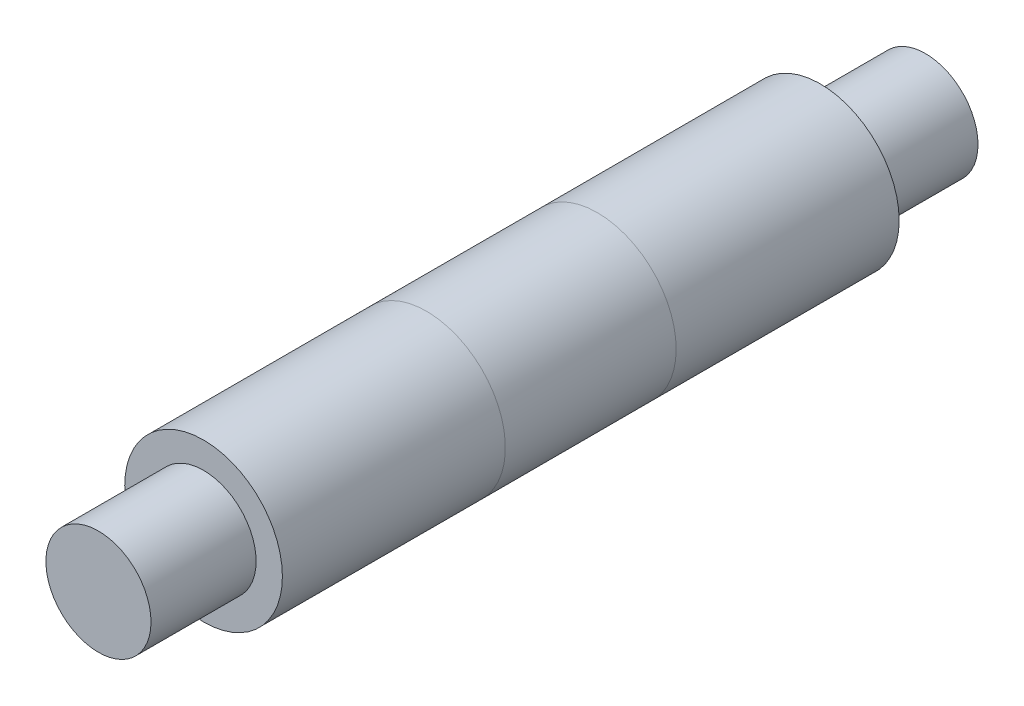
from build123d import *

# Parameters (mm, degrees)
SKETCH1_R    = 19.05
CENTER_DEPTH = 74.5236
SKETCH2_R    = 12.7
END_DEPTH    = 25.4


with BuildPart() as part:
    # Sketch1 → Center (new, symmetric)
    with BuildSketch(Plane.XY):
        Circle(SKETCH1_R)
    extrude(amount=CENTER_DEPTH, both=True)

    # Sketch2 → End (add)
    with BuildSketch(Plane.XY.offset(74.5236)):
        Circle(SKETCH2_R)
    end = extrude(amount=END_DEPTH)

    # Mirror1: End across plane
    add(end.mirror(Plane.XY))


solid = part.part
